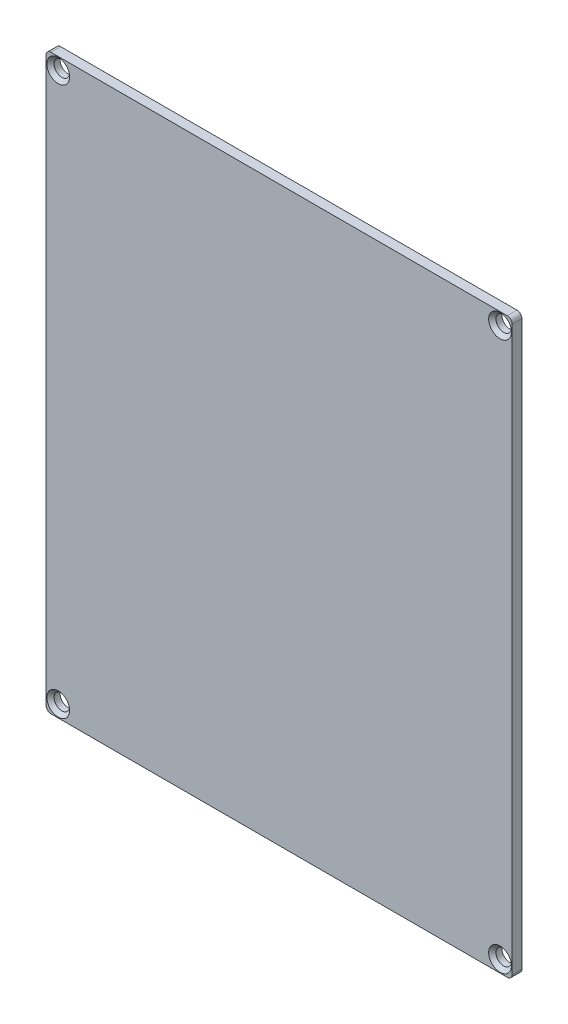
from build123d import *

# Parameters (mm, degrees)
SKIZZE1_W                       = 96
SKIZZE1_H                       = 118
SKIZZE1_R                       = 1.6
AUFSATZ_LINEAR_AUSTRAGEN2_DEPTH = 2
FASE2_SIZE                      = 0.75
VERRUNDUNG2_R                   = 1


with BuildPart() as part:
    # Skizze1 → Aufsatz-Linear austragen2 (new body)
    with BuildSketch(Plane.XY):
        Rectangle(SKIZZE1_W, SKIZZE1_H)
        with Locations((-45.5, 56.5)):
            Circle(SKIZZE1_R, mode=Mode.SUBTRACT)
        with Locations((45.5, 56.5)):
            Circle(SKIZZE1_R, mode=Mode.SUBTRACT)
        with Locations((45.5, -56.5)):
            Circle(SKIZZE1_R, mode=Mode.SUBTRACT)
        with Locations((-45.5, -56.5)):
            Circle(SKIZZE1_R, mode=Mode.SUBTRACT)
    extrude(amount=AUFSATZ_LINEAR_AUSTRAGEN2_DEPTH)

    # Fase2
    fase2_edges = [part.edges().sort_by_distance(p)[0] for p in [
        (-47.1, 56.5, 2),
        (43.9, 56.5, 2),
        (43.9, -56.5, 2),
        (-47.1, -56.5, 2),
    ]]
    chamfer(fase2_edges, length=FASE2_SIZE)

    # Verrundung2
    verrundung2_edges = [part.edges().sort_by_distance(p)[0] for p in [
        (48, -59, 1),
        (-48, -59, 1),
        (-48, 59, 1),
        (48, 59, 1),
    ]]
    fillet(verrundung2_edges, radius=VERRUNDUNG2_R)


solid = part.part
